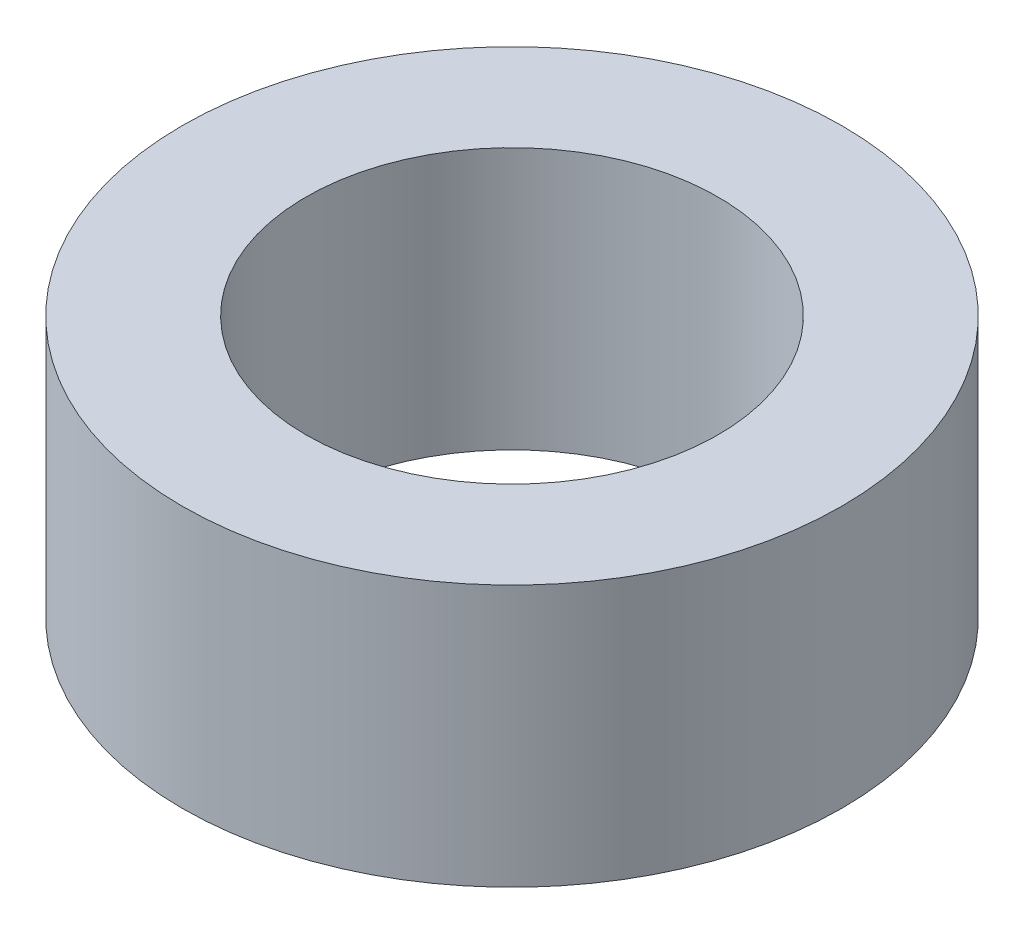
from build123d import *

# Parameters (mm, degrees)
SKETCH2_R           = 4
SKETCH2_R_2         = 2.5
BOSS_EXTRUDE1_DEPTH = 3.175


with BuildPart() as part:
    # Sketch2 → Boss-Extrude1 (new body)
    with BuildSketch(Plane(origin=(0, 0, 0), x_dir=(1, 0, 0), z_dir=(0, 1, 0))):
        with Locations(Location((0, 0, 0), (0, 0, 270))):
            Circle(SKETCH2_R)
        with Locations(Location((0, 0, 0), (0, 0, 270))):
            Circle(SKETCH2_R_2, mode=Mode.SUBTRACT)
    extrude(amount=BOSS_EXTRUDE1_DEPTH)


solid = part.part
